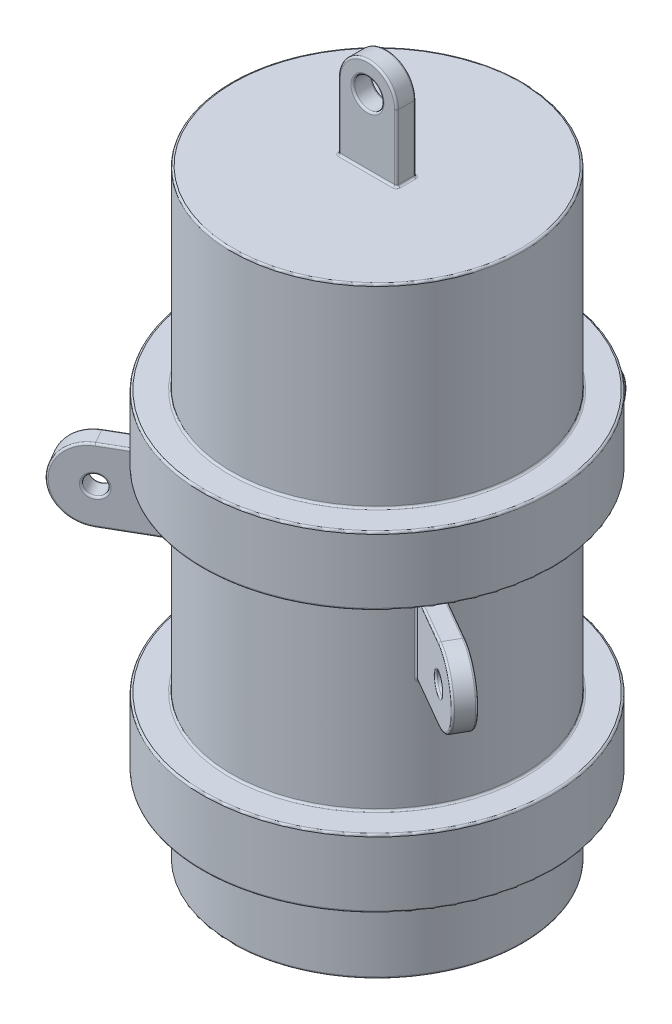
from build123d import *

# Parameters (mm, degrees)
SKETCH2_R           = 1.5
BOSS_EXTRUDE1_DEPTH = 1
SKETCH3_R           = 1
BOSS_EXTRUDE2_DEPTH = 1
CIRPATTERN1_COUNT   = 3
FILLET1_R           = 0.2


with BuildPart() as part:
    # Sketch1 → Revolve1 (revolve)
    with BuildSketch(Plane.XY, mode=Mode.PRIVATE) as revolve1_sk:
        Polygon((-4, 0), (-15, 0), (-15, 8), (-18, 8), (-18, 15), (-15, 15), (-15, 35), (-18, 35), (-18, 42), (-15, 42), (-15, 62), (0, 62), (0, 61), (-14, 61), (-14, 41), (-17, 41), (-17, 36), (-14, 36), (-14, 14), (-17, 14), (-17, 9), (-14, 9), (-14, 1), (-4, 1), align=None)
    revolve(revolve1_sk.sketch.rotate(Axis((0, 0, 0), (0, 1, 0)), 180), axis=Axis((0, 0, 0), (0, 1, 0)))

    # Sketch2 → Boss-Extrude1 (add, symmetric)
    with BuildSketch(Plane.XY):
        with BuildLine():
            Line((-3, 62), (3, 62))
            Line((3, 62), (3, 68.885133602))
            ThreePointArc((3, 68.885133602), (0, 71.885133602), (-3, 68.885133602))
            Line((-3, 68.885133602), (-3, 62))
        make_face()
        with Locations((0, 68.885133602)):
            Circle(SKETCH2_R, mode=Mode.SUBTRACT)
    extrude(amount=BOSS_EXTRUDE1_DEPTH, both=True)

    # Sketch3 → Boss-Extrude2 (add, symmetric)
    with BuildSketch(Plane(origin=(0, 0, 0), x_dir=(0, 0, -1), z_dir=(1, 0, 0))):
        with BuildLine():
            Line((14, 34), (21, 34))
            ThreePointArc((21, 34), (24.75, 30.25), (21, 26.5))
            Line((21, 26.5), (14, 26.5))
            Line((14, 26.5), (14, 34))
        make_face()
        with Locations((21, 30.25)):
            Circle(SKETCH3_R, mode=Mode.SUBTRACT)
    boss_extrude2 = extrude(amount=BOSS_EXTRUDE2_DEPTH, both=True)

    # CirPattern1: Boss-Extrude2 ×3 about axis
    cirpattern1_axis = Axis((0, 0, 0), (0, 1, 0))
    for i in range(1, CIRPATTERN1_COUNT):
        add(boss_extrude2.rotate(cirpattern1_axis, i * 360 / CIRPATTERN1_COUNT))

    # Fillet1
    fillet1_edges = [part.edges().sort_by_distance(p)[0] for p in [
        (13.461481397, 30.25, 6.61728937),
        (12.461481397, 30.25, 8.349340177),
        (15.074007438, 34, 9.857682791),
        (15.074007438, 26.5, 9.857682791),
        (20.934128744, 30.25, 13.241025404),
        (17.820508076, 30.25, 9.133974596),
        (12.990381057, 26.5, 7.5),
        (16.074007438, 26.5, 8.125631983),
        (16.074007438, 34, 8.125631983),
        (12.990381057, 34, 7.5),
        (21.934128744, 30.25, 11.508974596),
        (16.820508076, 30.25, 10.866025404),
        (-12.461481397, 30.25, 8.349340177),
        (-13.461481397, 30.25, 6.61728937),
        (-16.074007438, 34, 8.125631983),
        (-16.074007438, 26.5, 8.125631983),
        (-21.934128744, 30.25, 11.508974596),
        (-16.820508076, 30.25, 10.866025404),
        (-12.990381057, 26.5, 7.5),
        (-15.074007438, 26.5, 9.857682791),
        (-15.074007438, 34, 9.857682791),
        (-12.990381057, 34, 7.5),
        (-20.934128744, 30.25, 13.241025404),
        (-17.820508076, 30.25, 9.133974596),
        (-4, 1, 0),
        (-14, 1, 0),
        (-14, 9, 0),
        (-17, 9, 0),
        (-17, 14, 0),
        (-14, 14, 0),
        (-14, 36, 0),
        (-17, 36, 0),
        (-17, 41, 0),
        (-14, 41, 0),
        (-14, 61, 0),
        (-15, 62, 0),
        (-15, 42, 0),
        (-18, 42, 0),
        (-18, 35, 0),
        (-15, 35, 0),
        (-15, 15, 0),
        (-18, 15, 0),
        (-18, 8, 0),
        (-15, 8, 0),
        (-15, 0, 0),
        (-4, 0, 0),
        (-3, 65.442566801, 1),
        (0, 62, 1),
        (3, 65.442566801, 1),
        (0, 71.885133602, 1),
        (-1.5, 68.885133602, -1),
        (-3, 65.442566801, -1),
        (0, 62, -1),
        (-3, 62, 0),
        (3, 65.442566801, -1),
        (3, 62, 0),
        (0, 71.885133602, -1),
        (-1.5, 68.885133602, 1),
        (-1, 30.25, -14.966629547),
        (1, 30.25, -14.966629547),
        (1, 34, -17.983314774),
        (1, 26.5, -17.983314774),
        (1, 30.25, -24.75),
        (-1, 30.25, -20),
        (0, 26.5, -15),
        (-1, 26.5, -17.983314774),
        (-1, 34, -17.983314774),
        (0, 34, -15),
        (-1, 30.25, -24.75),
        (1, 30.25, -20),
    ]]
    fillet(fillet1_edges, radius=FILLET1_R)


solid = part.part
